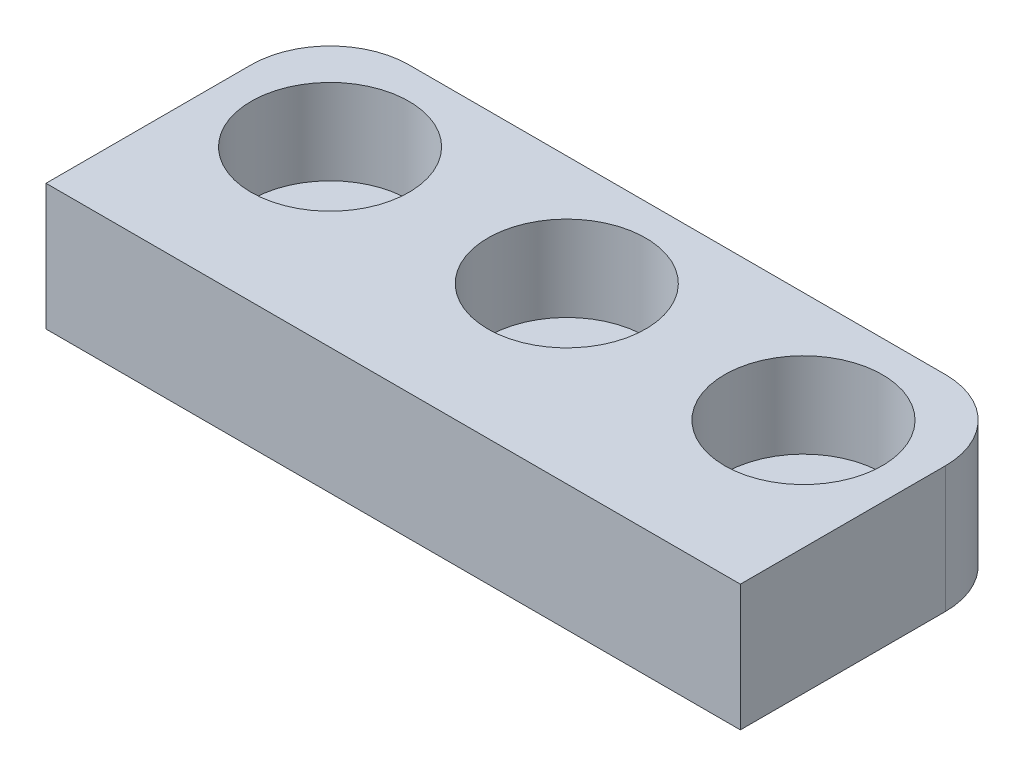
from build123d import *

# Parameters (mm, degrees)
SKETCH1_W                                           = 44
SKETCH1_H                                           = 18
BOSS_EXTRUDE1_DEPTH                                 = 8
CBORE_FOR_M5_HEX_SOCKET_HEAD_CAP_SCREW1_D           = 5.3
CBORE_FOR_M5_HEX_SOCKET_HEAD_CAP_SCREW1_CBORE_D     = 10
CBORE_FOR_M5_HEX_SOCKET_HEAD_CAP_SCREW1_CBORE_DEPTH = 5.4
FILLET1_R                                           = 5


with BuildPart() as part:
    # Sketch1 → Boss-Extrude1 (new body)
    with BuildSketch(Plane(origin=(0, 0, 0), x_dir=(1, 0, 0), z_dir=(0, 1, 0))):
        Rectangle(SKETCH1_W, SKETCH1_H)
    extrude(amount=-BOSS_EXTRUDE1_DEPTH)

    # CBORE for M5 Hex Socket Head Cap Screw1 (through all)
    with Locations(Plane(origin=(0, 0, 0), x_dir=(1, 0, 0), z_dir=(0, 1, 0))):
        with Locations((-15, 2), (0, 2), (15, 2)):
            CounterBoreHole(CBORE_FOR_M5_HEX_SOCKET_HEAD_CAP_SCREW1_D / 2, CBORE_FOR_M5_HEX_SOCKET_HEAD_CAP_SCREW1_CBORE_D / 2, CBORE_FOR_M5_HEX_SOCKET_HEAD_CAP_SCREW1_CBORE_DEPTH)

    # Fillet1
    fillet1_edges = [part.edges().sort_by_distance(p)[0] for p in [
        (-22, -4, -9),
        (22, -4, -9),
    ]]
    fillet(fillet1_edges, radius=FILLET1_R)


solid = part.part
